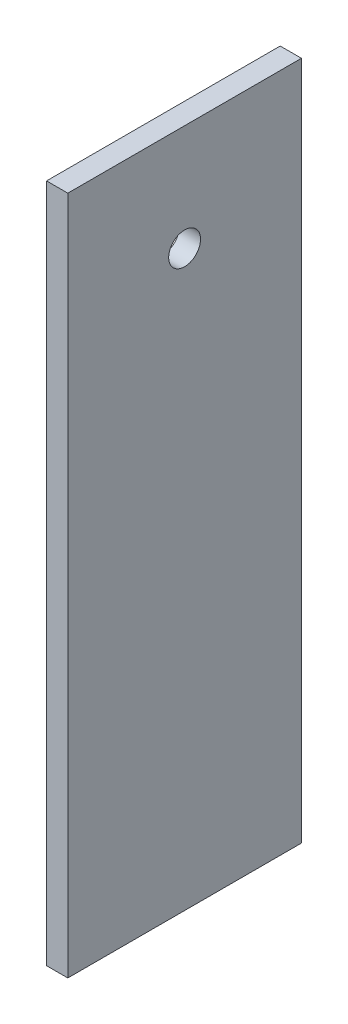
from build123d import *

# Parameters (mm, degrees)
CROQUIS1_W              = 550
CROQUIS1_H              = 1600
CROQUIS1_R              = 37.5
SALIENTE_EXTRUIR1_DEPTH = 50


with BuildPart() as part:
    # Croquis1 → Saliente-Extruir1 (new body)
    with BuildSketch(Plane(origin=(0, 0, 0), x_dir=(0, 0, -1), z_dir=(1, 0, 0))):
        Rectangle(CROQUIS1_W, CROQUIS1_H)
        with Locations((0, 550)):
            Circle(CROQUIS1_R, mode=Mode.SUBTRACT)
    extrude(amount=SALIENTE_EXTRUIR1_DEPTH)


solid = part.part
